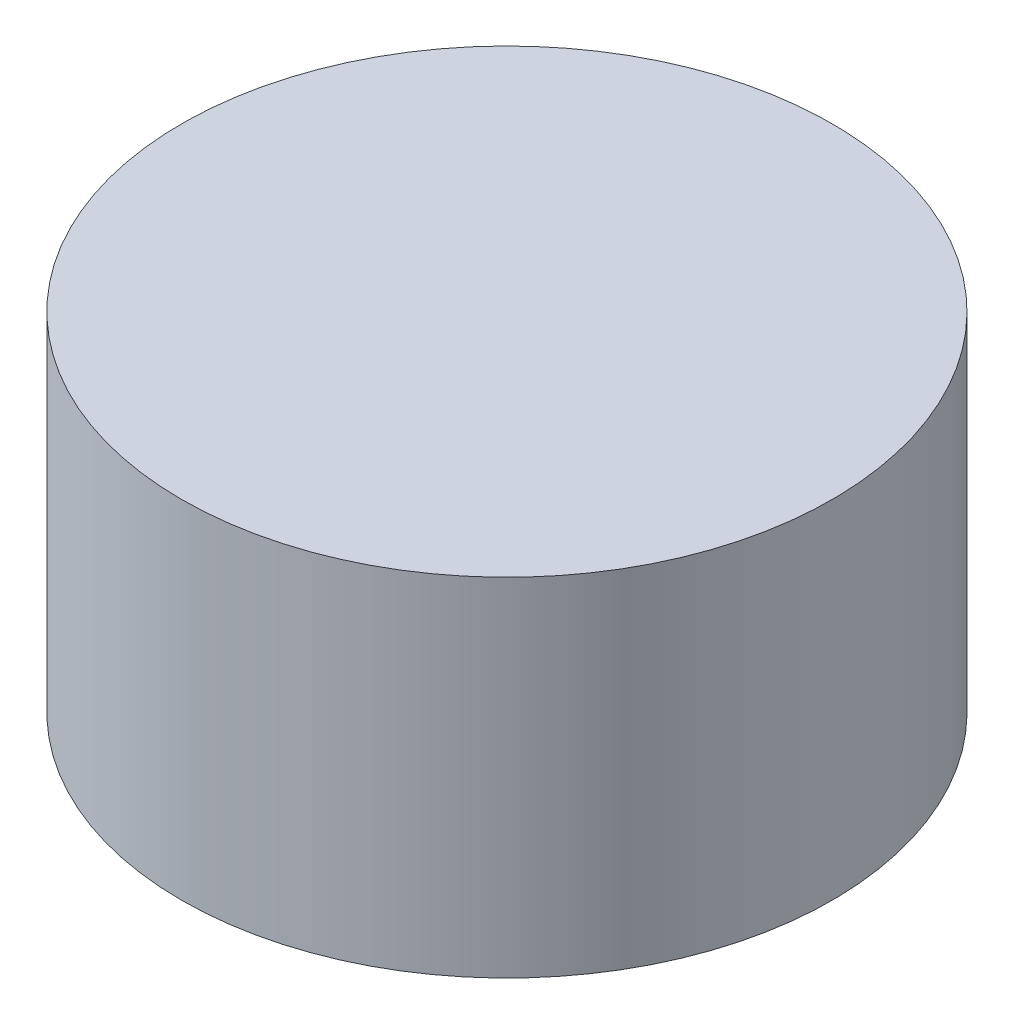
from build123d import *

# Parameters (mm, degrees)
SKETCH1_R           = 61.420668838
BOSS_EXTRUDE1_DEPTH = 65.532


with BuildPart() as part:
    # Sketch1 → Boss-Extrude1 (new body)
    with BuildSketch(Plane(origin=(0, 0, 0), x_dir=(1, 0, 0), z_dir=(0, 1, 0))):
        with Locations(Location((0, 0, 0), (0, 0, 270))):
            Circle(SKETCH1_R)
    extrude(amount=BOSS_EXTRUDE1_DEPTH)


solid = part.part
